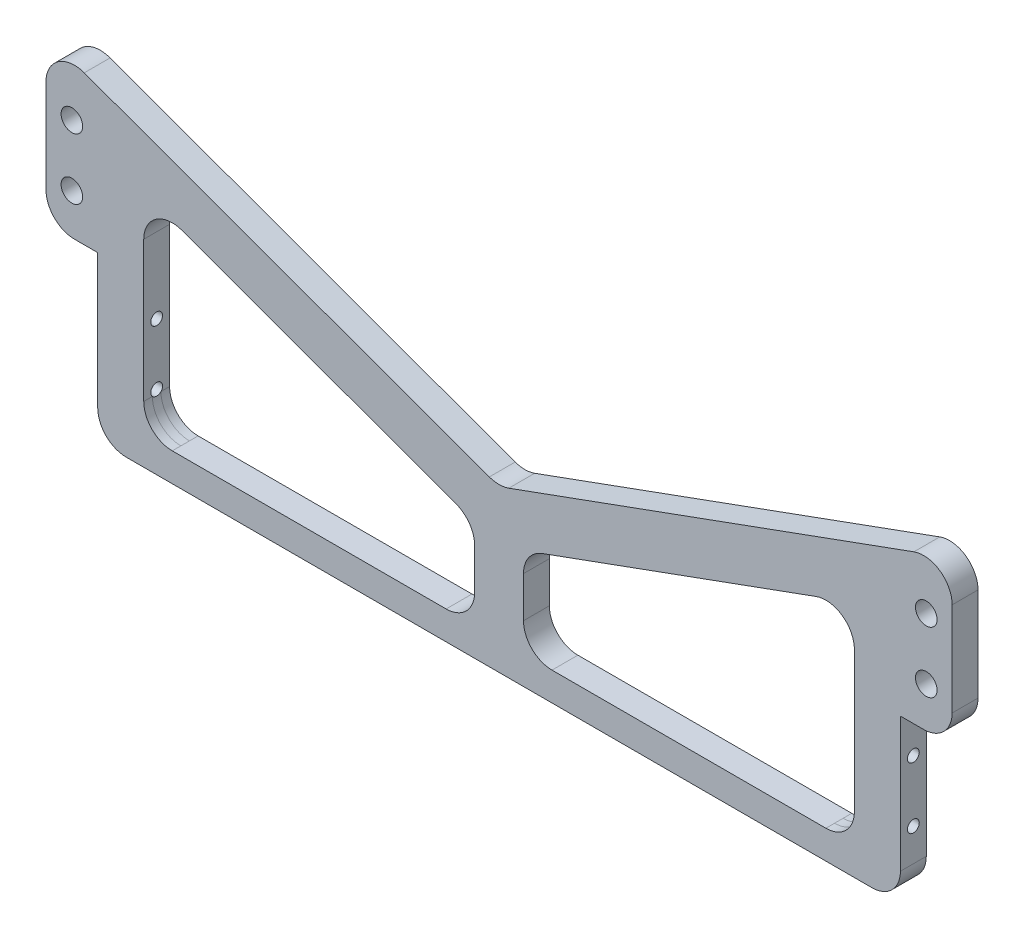
from build123d import *

# Parameters (mm, degrees)
SKETCH1_W                        = 222.5
SKETCH1_H                        = 80
BOSS_EXTRUDE1_DEPTH              = 6.35
SKETCH6_W                        = 6.35
SKETCH6_H                        = 40
CUT_EXTRUDE3_DEPTH               = 12.7
M3_5X0_6_TAPPED_HOLE1_AT_2_COUNT = 2
M3_5X0_6_TAPPED_HOLE1_AT_2_PITCH = 15
CUT_EXTRUDE1_DEPTH               = 119.392926309
CUT_EXTRUDE2_DEPTH               = 119.392926309
M5_CLEARANCE_HOLE1_D             = 5.3
FILLET1_R                        = 7


with BuildPart() as part:
    # Sketch1 → Boss-Extrude1 (new body)
    with BuildSketch(Plane.XY):
        Rectangle(SKETCH1_W, SKETCH1_H)
    extrude(amount=BOSS_EXTRUDE1_DEPTH)

    # Sketch6 → Cut-Extrude3 (cut)
    with BuildSketch(Plane.ZY.offset(111.25)):
        with Locations((3.175, -20)):
            Rectangle(SKETCH6_W, SKETCH6_H)
    cut_extrude3 = extrude(amount=-CUT_EXTRUDE3_DEPTH, mode=Mode.SUBTRACT)

    # Sketch7 → M3.5x0.6 Tapped Hole1 (revolve, cut)
    with BuildSketch(Plane(origin=(-98.55, -25, 3.175), x_dir=(0, 0, 1), z_dir=(0, 1, 0))):
        Polygon((0, 0), (0, 14.671247898), (1.45, 13.8), (1.45, 0), align=None)
    m3_5x0_6_tapped_hole1 = revolve(axis=Axis((-104.9, -25, 3.175), (1, 0, 0)), mode=Mode.SUBTRACT)

    # M3.5x0.6 Tapped Hole1 at 2: M3.5x0.6 Tapped Hole1 ×2
    with Locations(*[(0, i * M3_5X0_6_TAPPED_HOLE1_AT_2_PITCH, 0) for i in range(1, M3_5X0_6_TAPPED_HOLE1_AT_2_COUNT)]):
        add(m3_5x0_6_tapped_hole1, mode=Mode.SUBTRACT)

    # Sketch2 → Cut-Extrude1 (cut, through all)
    with BuildSketch(Plane.XY.offset(6.35)):
        Polygon((111.25, 40), (0, -0.491688562), (-111.25, 40), align=None)
    extrude(amount=-CUT_EXTRUDE1_DEPTH, mode=Mode.SUBTRACT)

    # Sketch3 → Cut-Extrude2 (cut, through all)
    with BuildSketch(Plane.XY.offset(6.35)):
        Polygon((-87.25, -33), (-87.25, 18.494581108), (-6, -11.078000426), (-6, -33), align=None)
    cut_extrude2 = extrude(amount=-CUT_EXTRUDE2_DEPTH, mode=Mode.SUBTRACT)

    # M5 Clearance Hole1 (through all)
    with Locations(Plane(origin=(0, 0, 0), x_dir=(-1, 0, 0), z_dir=(0, 0, -1))):
        with Locations((104.9, 10), (104.9, 25)):
            m5_clearance_hole1 = Hole(M5_CLEARANCE_HOLE1_D / 2)

    # Mirror1: Cut-Extrude3, M3.5x0.6 Tapped Hole1, Cut-Extrude2, M5 Clearance Hole1 across plane
    add(cut_extrude3.mirror(Plane(origin=(0, 0, 0), x_dir=(0, 0, 1), z_dir=(1, 0, 0))), mode=Mode.SUBTRACT)
    add(m3_5x0_6_tapped_hole1.mirror(Plane(origin=(0, 0, 0), x_dir=(0, 0, 1), z_dir=(1, 0, 0))), mode=Mode.SUBTRACT)
    add(cut_extrude2.mirror(Plane(origin=(0, 0, 0), x_dir=(0, 0, 1), z_dir=(1, 0, 0))), mode=Mode.SUBTRACT)
    add(m5_clearance_hole1.mirror(Plane(origin=(0, 0, 0), x_dir=(0, 0, 1), z_dir=(1, 0, 0))), mode=Mode.SUBTRACT)

    # Mirror1 copy 1 sketch → Mirror1 copy 1 (revolve, cut)
    with BuildSketch(Plane(origin=(98.55, -10, 3.175), x_dir=(0, 0, 1), z_dir=(0, 1, 0))):
        Polygon((0, 0), (0, -14.671247898), (1.45, -13.8), (1.45, 0), align=None)
    revolve(axis=Axis((104.9, -10, 3.175), (1, 0, 0)), mode=Mode.SUBTRACT)

    # Fillet1
    fillet1_edges = [part.edges().sort_by_distance(p)[0] for p in [
        (87.25, 18.494581108, 3.175),
        (87.25, -33, 3.175),
        (6, -33, 3.175),
        (6, -11.078000426, 3.175),
        (-98.55, -40, 3.175),
        (-111.25, 0, 3.175),
        (0, -0.491688562, 3.175),
        (-87.25, -33, 3.175),
        (-6, -33, 3.175),
        (-87.25, 18.494581108, 3.175),
        (-6, -11.078000426, 3.175),
        (-111.25, 40, 3.175),
        (111.25, 40, 3.175),
        (111.25, 0, 3.175),
        (98.55, -40, 3.175),
    ]]
    fillet(fillet1_edges, radius=FILLET1_R)


solid = part.part
